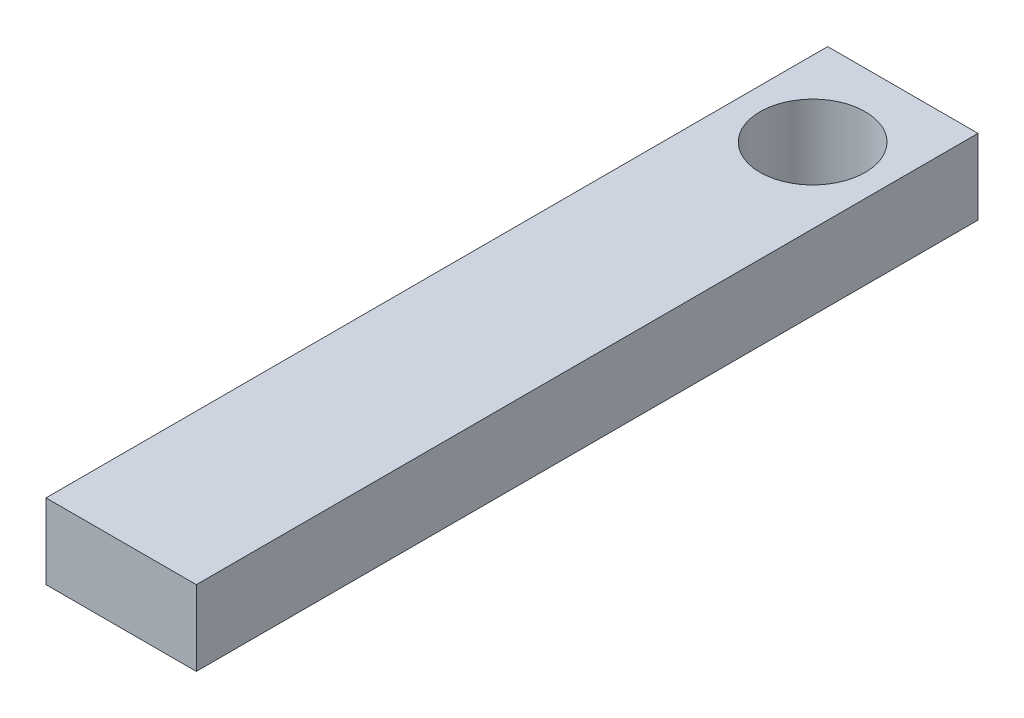
from build123d import *

# Parameters (mm, degrees)
SKETCH1_W           = 10
SKETCH1_H           = 52
SKETCH1_R           = 3.5
BOSS_EXTRUDE1_DEPTH = 5


with BuildPart() as part:
    # Sketch1 → Boss-Extrude1 (new body)
    with BuildSketch(Plane(origin=(0, 0, 0), x_dir=(1, 0, 0), z_dir=(0, 1, 0))):
        with Locations((5, 26)):
            Rectangle(SKETCH1_W, SKETCH1_H)
        with Locations(Location((5, 46, 0), (0, 0, 270))):
            Circle(SKETCH1_R, mode=Mode.SUBTRACT)
    extrude(amount=BOSS_EXTRUDE1_DEPTH)


solid = part.part
